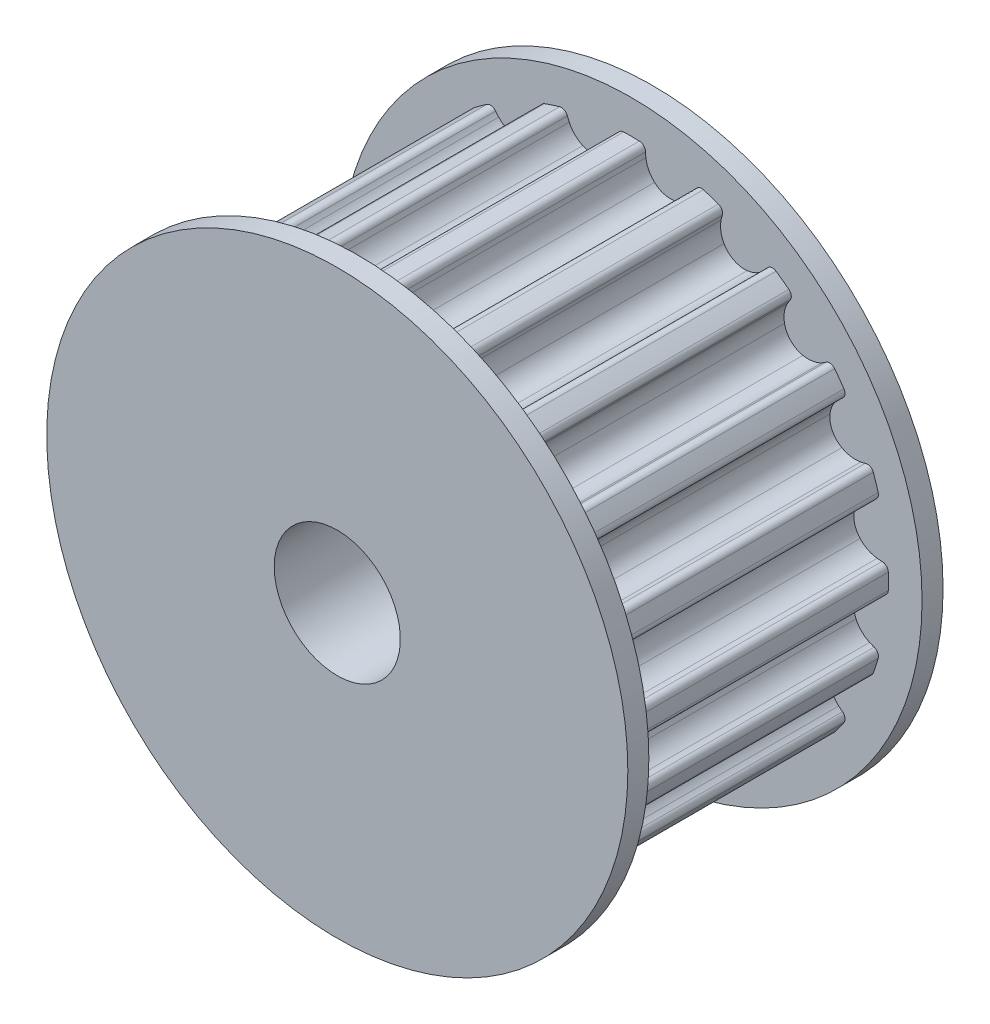
from build123d import *

# Parameters (mm, degrees)
BOSS_EXTRUDE1_DEPTH          = 6.5
CIRPATTERN1_COUNT            = 20
SKETCH2_R                    = 5.362197724
BOSS_EXTRUDE2_DEPTH          = 6.5
SCHIZZO1_R                   = 6.912197724
ESTRUSIONE_ESTRUSIONE1_DEPTH = 0.5
SCHIZZO3_R                   = 1.5
TAGLIO_ESTRUSIONE2_DEPTH     = 13.3209965
TAGLIO_ESTRUSIONE1_DEPTH     = 5.1


with BuildPart() as part:
    # Sketch1 → Boss-Extrude1 (new body)
    with BuildSketch(Plane.XY):
        with BuildLine():
            ThreePointArc((0.838832532, 5.296180172), (0.682371389, 5.345509816), (0.547166891, 5.438425083))
            ThreePointArc((0.547166891, 5.438425083), (0.408048432, 5.623143766), (0.340639395, 5.844347201))
            ThreePointArc((0.340639395, 5.844347201), (0.335313092, 5.902123138), (0.333346558, 5.960110732))
            ThreePointArc((0.333346558, 5.960110732), (0.290777478, 6.064063067), (0.187961119, 6.109306968))
            ThreePointArc((0.187961119, 6.109306968), (0, 6.112197724), (-0.187961119, 6.109306968))
            ThreePointArc((-0.187961119, 6.109306968), (-0.290777478, 6.064063067), (-0.333346558, 5.960110732))
            ThreePointArc((-0.333346558, 5.960110732), (-0.335313092, 5.902123138), (-0.340639395, 5.844347201))
            ThreePointArc((-0.340639395, 5.844347201), (-0.408048432, 5.623143766), (-0.547166891, 5.438425083))
            ThreePointArc((-0.547166891, 5.438425083), (-0.682371389, 5.345509816), (-0.838832532, 5.296180172))
            ThreePointArc((-0.838832532, 5.296180172), (0, 5.362197724), (0.838832532, 5.296180172))
        make_face()
    extrude(amount=BOSS_EXTRUDE1_DEPTH)


with BuildPart() as cirpattern1_1:
    # CirPattern1: pattern copy
    add(part.part.rotate(Axis((0, 0, 0), (0, 0, 1)), 1 * 360 / CIRPATTERN1_COUNT))


with BuildPart() as cirpattern1_2:
    # CirPattern1: pattern copy
    add(part.part.rotate(Axis((0, 0, 0), (0, 0, 1)), 2 * 360 / CIRPATTERN1_COUNT))


with BuildPart() as cirpattern1_3:
    # CirPattern1: pattern copy
    add(part.part.rotate(Axis((0, 0, 0), (0, 0, 1)), 3 * 360 / CIRPATTERN1_COUNT))


with BuildPart() as cirpattern1_4:
    # CirPattern1: pattern copy
    add(part.part.rotate(Axis((0, 0, 0), (0, 0, 1)), 4 * 360 / CIRPATTERN1_COUNT))


with BuildPart() as cirpattern1_5:
    # CirPattern1: pattern copy
    add(part.part.rotate(Axis((0, 0, 0), (0, 0, 1)), 5 * 360 / CIRPATTERN1_COUNT))


with BuildPart() as cirpattern1_6:
    # CirPattern1: pattern copy
    add(part.part.rotate(Axis((0, 0, 0), (0, 0, 1)), 6 * 360 / CIRPATTERN1_COUNT))


with BuildPart() as cirpattern1_7:
    # CirPattern1: pattern copy
    add(part.part.rotate(Axis((0, 0, 0), (0, 0, 1)), 7 * 360 / CIRPATTERN1_COUNT))


with BuildPart() as cirpattern1_8:
    # CirPattern1: pattern copy
    add(part.part.rotate(Axis((0, 0, 0), (0, 0, 1)), 8 * 360 / CIRPATTERN1_COUNT))


with BuildPart() as cirpattern1_9:
    # CirPattern1: pattern copy
    add(part.part.rotate(Axis((0, 0, 0), (0, 0, 1)), 9 * 360 / CIRPATTERN1_COUNT))


with BuildPart() as cirpattern1_10:
    # CirPattern1: pattern copy
    add(part.part.rotate(Axis((0, 0, 0), (0, 0, 1)), 10 * 360 / CIRPATTERN1_COUNT))


with BuildPart() as cirpattern1_11:
    # CirPattern1: pattern copy
    add(part.part.rotate(Axis((0, 0, 0), (0, 0, 1)), 11 * 360 / CIRPATTERN1_COUNT))


with BuildPart() as cirpattern1_12:
    # CirPattern1: pattern copy
    add(part.part.rotate(Axis((0, 0, 0), (0, 0, 1)), 12 * 360 / CIRPATTERN1_COUNT))


with BuildPart() as cirpattern1_13:
    # CirPattern1: pattern copy
    add(part.part.rotate(Axis((0, 0, 0), (0, 0, 1)), 13 * 360 / CIRPATTERN1_COUNT))


with BuildPart() as cirpattern1_14:
    # CirPattern1: pattern copy
    add(part.part.rotate(Axis((0, 0, 0), (0, 0, 1)), 14 * 360 / CIRPATTERN1_COUNT))


with BuildPart() as cirpattern1_15:
    # CirPattern1: pattern copy
    add(part.part.rotate(Axis((0, 0, 0), (0, 0, 1)), 15 * 360 / CIRPATTERN1_COUNT))


with BuildPart() as cirpattern1_16:
    # CirPattern1: pattern copy
    add(part.part.rotate(Axis((0, 0, 0), (0, 0, 1)), 16 * 360 / CIRPATTERN1_COUNT))


with BuildPart() as cirpattern1_17:
    # CirPattern1: pattern copy
    add(part.part.rotate(Axis((0, 0, 0), (0, 0, 1)), 17 * 360 / CIRPATTERN1_COUNT))


with BuildPart() as cirpattern1_18:
    # CirPattern1: pattern copy
    add(part.part.rotate(Axis((0, 0, 0), (0, 0, 1)), 18 * 360 / CIRPATTERN1_COUNT))


with BuildPart() as cirpattern1_19:
    # CirPattern1: pattern copy
    add(part.part.rotate(Axis((0, 0, 0), (0, 0, 1)), 19 * 360 / CIRPATTERN1_COUNT))


with BuildPart() as part_1:
    add(part.part)

    add(cirpattern1_1.part)  # Boss-Extrude2 merges CirPattern1_1

    add(cirpattern1_2.part)  # Boss-Extrude2 merges CirPattern1_2

    add(cirpattern1_3.part)  # Boss-Extrude2 merges CirPattern1_3

    add(cirpattern1_4.part)  # Boss-Extrude2 merges CirPattern1_4

    add(cirpattern1_5.part)  # Boss-Extrude2 merges CirPattern1_5

    add(cirpattern1_6.part)  # Boss-Extrude2 merges CirPattern1_6

    add(cirpattern1_7.part)  # Boss-Extrude2 merges CirPattern1_7

    add(cirpattern1_8.part)  # Boss-Extrude2 merges CirPattern1_8

    add(cirpattern1_9.part)  # Boss-Extrude2 merges CirPattern1_9

    add(cirpattern1_10.part)  # Boss-Extrude2 merges CirPattern1_10

    add(cirpattern1_11.part)  # Boss-Extrude2 merges CirPattern1_11

    add(cirpattern1_12.part)  # Boss-Extrude2 merges CirPattern1_12

    add(cirpattern1_13.part)  # Boss-Extrude2 merges CirPattern1_13

    add(cirpattern1_14.part)  # Boss-Extrude2 merges CirPattern1_14

    add(cirpattern1_15.part)  # Boss-Extrude2 merges CirPattern1_15

    add(cirpattern1_16.part)  # Boss-Extrude2 merges CirPattern1_16

    add(cirpattern1_17.part)  # Boss-Extrude2 merges CirPattern1_17

    add(cirpattern1_18.part)  # Boss-Extrude2 merges CirPattern1_18

    add(cirpattern1_19.part)  # Boss-Extrude2 merges CirPattern1_19
    # Sketch2 → Boss-Extrude2 (add)
    with BuildSketch(Plane(origin=(0, 0, 0), x_dir=(-1, 0, 0), z_dir=(0, 0, -1))):
        Circle(SKETCH2_R)
    extrude(amount=-BOSS_EXTRUDE2_DEPTH)

    # Schizzo1 → Estrusione-Estrusione1 (add)
    with BuildSketch(Plane.XY.offset(6.5)):
        Circle(SCHIZZO1_R)
    estrusione_estrusione1 = extrude(amount=ESTRUSIONE_ESTRUSIONE1_DEPTH)

    # Specchia1: Estrusione-Estrusione1 across plane
    add(estrusione_estrusione1.mirror(Plane(origin=(0, 0, 3.25), x_dir=(1, 0, 0), z_dir=(0, 0, -1))))

    # Schizzo3 → Taglio-Estrusione2 (cut, through all)
    with BuildSketch(Plane(origin=(0, 0, -0.5), x_dir=(-1, 0, 0), z_dir=(0, 0, -1))):
        Circle(SCHIZZO3_R)
    extrude(amount=-TAGLIO_ESTRUSIONE2_DEPTH, mode=Mode.SUBTRACT)

    # Schizzo2 → Taglio-Estrusione1 (cut)
    with BuildSketch(Plane(origin=(0, 0, -0.5), x_dir=(-1, 0, 0), z_dir=(0, 0, -1))):
        with BuildLine():
            ThreePointArc((-0.208737292, 3.467723279), (-0.347792953, 4.050804848), (-0.680582711, 4.549374372))
            ThreePointArc((-0.680582711, 4.549374372), (-0.897415481, 4.51161229), (-1.112193763, 4.463521595))
            ThreePointArc((-1.112193763, 4.463521595), (-1.228857112, 3.87555029), (-1.134192135, 3.283638866))
            ThreePointArc((-1.134192135, 3.283638866), (-1.329442244, 3.209557496), (-1.519888359, 3.123878259))
            ThreePointArc((-1.519888359, 3.123878259), (-1.871494694, 3.609361089), (-2.369746636, 3.94262614))
            ThreePointArc((-2.369746636, 3.94262614), (-2.555623072, 3.824760217), (-2.735648818, 3.698138118))
            ThreePointArc((-2.735648818, 3.698138118), (-2.618424822, 3.110278333), (-2.304451091, 2.599650201))
            ThreePointArc((-2.304451091, 2.599650201), (-2.456488958, 2.456488958), (-2.599650201, 2.304451091))
            ThreePointArc((-2.599650201, 2.304451091), (-3.110278333, 2.618424822), (-3.698138118, 2.735648818))
            ThreePointArc((-3.698138118, 2.735648818), (-3.824760217, 2.555623072), (-3.94262614, 2.369746636))
            ThreePointArc((-3.94262614, 2.369746636), (-3.609361089, 1.871494694), (-3.123878259, 1.519888359))
            ThreePointArc((-3.123878259, 1.519888359), (-3.209557496, 1.329442244), (-3.283638866, 1.134192135))
            ThreePointArc((-3.283638866, 1.134192135), (-3.87555029, 1.228857112), (-4.463521595, 1.112193763))
            ThreePointArc((-4.463521595, 1.112193763), (-4.51161229, 0.897415481), (-4.549374372, 0.680582711))
            ThreePointArc((-4.549374372, 0.680582711), (-4.050804848, 0.347792953), (-3.467723279, 0.208737292))
            ThreePointArc((-3.467723279, 0.208737292), (-3.474, 0), (-3.467723279, -0.208737292))
            ThreePointArc((-3.467723279, -0.208737292), (-4.050804848, -0.347792953), (-4.549374372, -0.680582711))
            ThreePointArc((-4.549374372, -0.680582711), (-4.51161229, -0.897415481), (-4.463521595, -1.112193763))
            ThreePointArc((-4.463521595, -1.112193763), (-3.87555029, -1.228857112), (-3.283638866, -1.134192135))
            ThreePointArc((-3.283638866, -1.134192135), (-3.209557496, -1.329442244), (-3.123878259, -1.519888359))
            ThreePointArc((-3.123878259, -1.519888359), (-3.609361089, -1.871494694), (-3.94262614, -2.369746636))
            ThreePointArc((-3.94262614, -2.369746636), (-3.824760217, -2.555623072), (-3.698138118, -2.735648818))
            ThreePointArc((-3.698138118, -2.735648818), (-3.110278333, -2.618424822), (-2.599650201, -2.304451091))
            ThreePointArc((-2.599650201, -2.304451091), (-2.456488958, -2.456488958), (-2.304451091, -2.599650201))
            ThreePointArc((-2.304451091, -2.599650201), (-2.618424822, -3.110278333), (-2.735648818, -3.698138118))
            ThreePointArc((-2.735648818, -3.698138118), (-2.555623072, -3.824760217), (-2.369746636, -3.94262614))
            ThreePointArc((-2.369746636, -3.94262614), (-1.871494694, -3.609361089), (-1.519888359, -3.123878259))
            ThreePointArc((-1.519888359, -3.123878259), (-1.329442244, -3.209557496), (-1.134192135, -3.283638866))
            ThreePointArc((-1.134192135, -3.283638866), (-1.228857112, -3.87555029), (-1.112193763, -4.463521595))
            ThreePointArc((-1.112193763, -4.463521595), (-0.897415481, -4.51161229), (-0.680582711, -4.549374372))
            ThreePointArc((-0.680582711, -4.549374372), (-0.347792953, -4.050804848), (-0.208737292, -3.467723279))
            ThreePointArc((-0.208737292, -3.467723279), (0, -3.474), (0.208737292, -3.467723279))
            ThreePointArc((0.208737292, -3.467723279), (0.347792953, -4.050804848), (0.680582711, -4.549374372))
            ThreePointArc((0.680582711, -4.549374372), (0.897415481, -4.51161229), (1.112193763, -4.463521595))
            ThreePointArc((1.112193763, -4.463521595), (1.228857112, -3.87555029), (1.134192135, -3.283638866))
            ThreePointArc((1.134192135, -3.283638866), (1.329442244, -3.209557496), (1.519888359, -3.123878259))
            ThreePointArc((1.519888359, -3.123878259), (1.871494694, -3.609361089), (2.369746636, -3.94262614))
            ThreePointArc((2.369746636, -3.94262614), (2.555623072, -3.824760217), (2.735648818, -3.698138118))
            ThreePointArc((2.735648818, -3.698138118), (2.618424822, -3.110278333), (2.304451091, -2.599650201))
            ThreePointArc((2.304451091, -2.599650201), (2.456488958, -2.456488958), (2.599650201, -2.304451091))
            ThreePointArc((2.599650201, -2.304451091), (3.110278333, -2.618424822), (3.698138118, -2.735648818))
            ThreePointArc((3.698138118, -2.735648818), (3.824760217, -2.555623072), (3.94262614, -2.369746636))
            ThreePointArc((3.94262614, -2.369746636), (3.609361089, -1.871494694), (3.123878259, -1.519888359))
            ThreePointArc((3.123878259, -1.519888359), (3.209557496, -1.329442244), (3.283638866, -1.134192135))
            ThreePointArc((3.283638866, -1.134192135), (3.87555029, -1.228857112), (4.463521595, -1.112193763))
            ThreePointArc((4.463521595, -1.112193763), (4.51161229, -0.897415481), (4.549374372, -0.680582711))
            ThreePointArc((4.549374372, -0.680582711), (4.050804848, -0.347792953), (3.467723279, -0.208737292))
            ThreePointArc((3.467723279, -0.208737292), (3.474, 0), (3.467723279, 0.208737292))
            ThreePointArc((3.467723279, 0.208737292), (4.050804848, 0.347792953), (4.549374372, 0.680582711))
            ThreePointArc((4.549374372, 0.680582711), (4.51161229, 0.897415481), (4.463521595, 1.112193763))
            ThreePointArc((4.463521595, 1.112193763), (3.87555029, 1.228857112), (3.283638866, 1.134192135))
            ThreePointArc((3.283638866, 1.134192135), (3.209557496, 1.329442244), (3.123878259, 1.519888359))
            ThreePointArc((3.123878259, 1.519888359), (3.609361089, 1.871494694), (3.94262614, 2.369746636))
            ThreePointArc((3.94262614, 2.369746636), (3.824760217, 2.555623072), (3.698138118, 2.735648818))
            ThreePointArc((3.698138118, 2.735648818), (3.110278333, 2.618424822), (2.599650201, 2.304451091))
            ThreePointArc((2.599650201, 2.304451091), (2.456488958, 2.456488958), (2.304451091, 2.599650201))
            ThreePointArc((2.304451091, 2.599650201), (2.618424822, 3.110278333), (2.735648818, 3.698138118))
            ThreePointArc((2.735648818, 3.698138118), (2.555623072, 3.824760217), (2.369746636, 3.94262614))
            ThreePointArc((2.369746636, 3.94262614), (1.871494694, 3.609361089), (1.519888359, 3.123878259))
            ThreePointArc((1.519888359, 3.123878259), (1.329442244, 3.209557496), (1.134192135, 3.283638866))
            ThreePointArc((1.134192135, 3.283638866), (1.228857112, 3.87555029), (1.112193763, 4.463521595))
            ThreePointArc((1.112193763, 4.463521595), (0.897415481, 4.51161229), (0.680582711, 4.549374372))
            ThreePointArc((0.680582711, 4.549374372), (0.347792953, 4.050804848), (0.208737292, 3.467723279))
            ThreePointArc((0.208737292, 3.467723279), (0, 3.474), (-0.208737292, 3.467723279))
        make_face()
    extrude(amount=-TAGLIO_ESTRUSIONE1_DEPTH, mode=Mode.SUBTRACT)


solid = part_1.part
